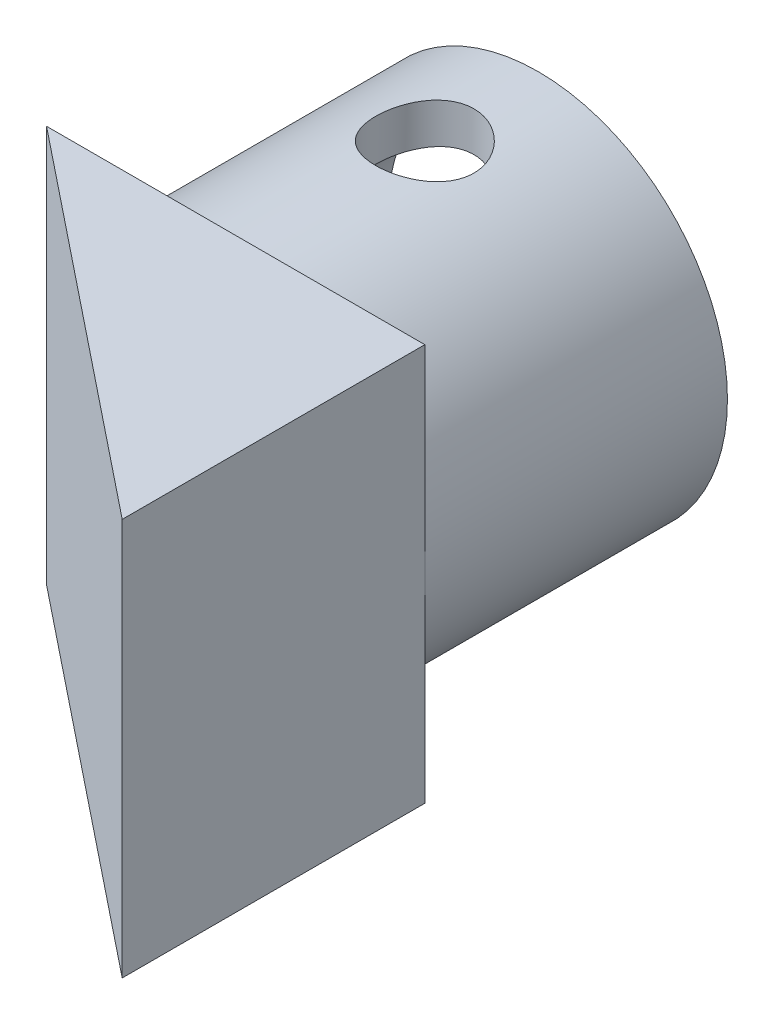
from build123d import *

# Parameters (mm, degrees)
SKETCH1_R                = 5
SKETCH1_R_2              = 3.95
BOSS_EXTRUDE1_DEPTH      = 8
BOSS_EXTRUDE2_DEPTH      = 5.25
BOSS_EXTRUDE2_DEPTH_BACK = 5.25
CUT_EXTRUDE1_DEPTH       = 18.565947171
CUT_EXTRUDE1_DEPTH_BACK  = 18.565947171
SKETCH4_R                = 1.3


with BuildPart() as part:
    # Sketch1 → Boss-Extrude1 (new body)
    with BuildSketch(Plane.XY):
        Circle(SKETCH1_R)
        Circle(SKETCH1_R_2, mode=Mode.SUBTRACT)
    extrude(amount=BOSS_EXTRUDE1_DEPTH)

    # Sketch3 → Boss-Extrude2 (add, two sides: drawn at the far end of the back side and taken through both)
    with BuildSketch(Plane(origin=(0, 0, 0), x_dir=(1, 0, 0), z_dir=(0, 1, 0)).offset(-BOSS_EXTRUDE2_DEPTH_BACK)):
        Polygon((5, -16), (-5, -8), (5, -8), align=None)
    extrude(amount=BOSS_EXTRUDE2_DEPTH + BOSS_EXTRUDE2_DEPTH_BACK)

    # Sketch4 → Cut-Extrude1 (cut, two sides: drawn at the far end of the back side and taken through both)
    with BuildSketch(Plane(origin=(0, 0, 0), x_dir=(1, 0, 0), z_dir=(0, 1, 0)).offset(-CUT_EXTRUDE1_DEPTH_BACK)):
        with Locations((0, -3)):
            Circle(SKETCH4_R)
    extrude(amount=CUT_EXTRUDE1_DEPTH + CUT_EXTRUDE1_DEPTH_BACK, mode=Mode.SUBTRACT)


solid = part.part
